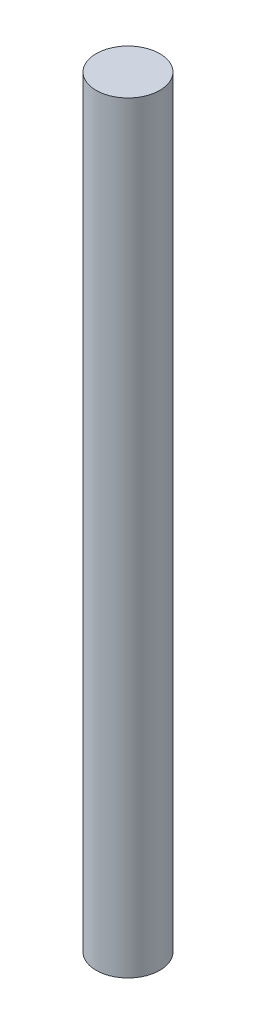
from build123d import *

# Parameters (mm, degrees)
CROQUIS5_R              = 3.175
SALIENTE_EXTRUIR2_DEPTH = 76


with BuildPart() as part:
    # Croquis5 → Saliente-Extruir2 (new body)
    with BuildSketch(Plane(origin=(0, 0, 0), x_dir=(1, 0, 0), z_dir=(0, 1, 0))):
        with Locations(Location((0, 0, 0), (0, 0, 270))):
            Circle(CROQUIS5_R)
    extrude(amount=SALIENTE_EXTRUIR2_DEPTH)


solid = part.part
